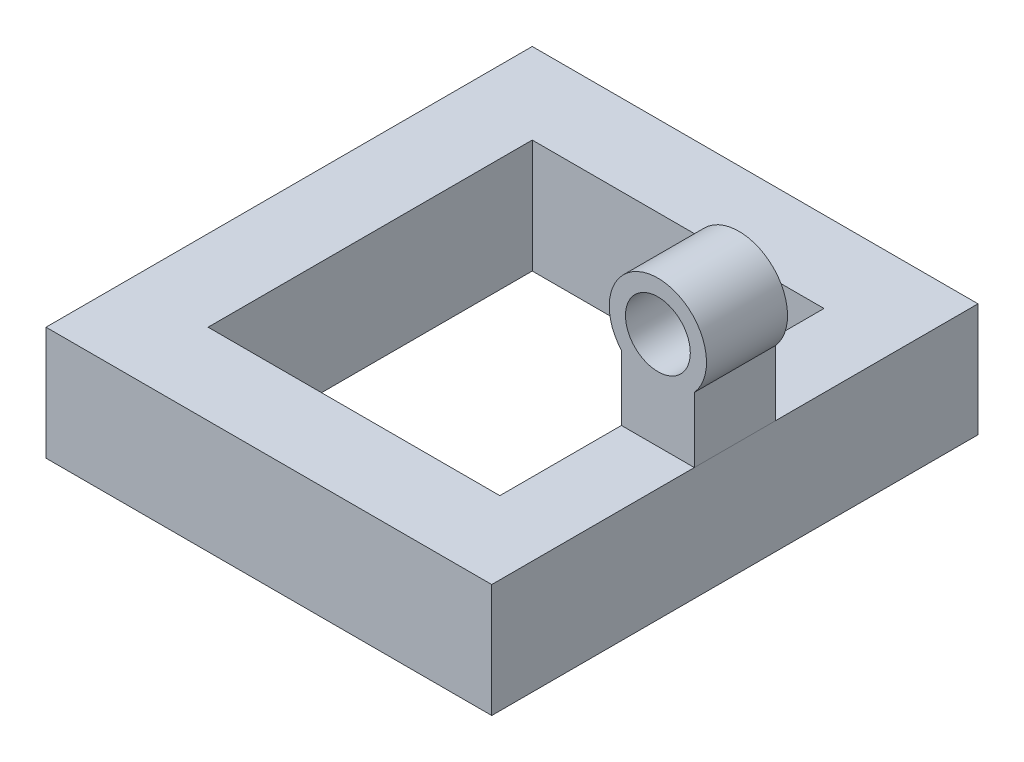
from build123d import *

# Parameters (mm, degrees)
SKETCH_1_W          = 55
SKETCH_1_H          = 60
EXTRUDE_1_DEPTH     = 14
SKETCH_5_W          = 36
SKETCH_5_H          = 40
CUT_EXTRUDE_1_DEPTH = 15
EXTRUDE_START       = -35
SKETCH_7_R          = 4
EXTRUDE_2_DEPTH     = 10


with BuildPart() as part:
    # 草图1 → 凸台-拉伸1 (new body)
    with BuildSketch(Plane(origin=(0, 0, 0), x_dir=(1, 0, 0), z_dir=(0, 1, 0))):
        with Locations((27.5, 30)):
            Rectangle(SKETCH_1_W, SKETCH_1_H)
    extrude(amount=EXTRUDE_1_DEPTH)

    # 草图5 → 切除-拉伸1 (cut)
    with BuildSketch(Plane(origin=(0, 0, 0), x_dir=(1, 0, 0), z_dir=(0, 1, 0))):
        with Locations((28, 30)):
            Rectangle(SKETCH_5_W, SKETCH_5_H)
    extrude(amount=CUT_EXTRUDE_1_DEPTH, mode=Mode.SUBTRACT)


with BuildPart() as body_2:
    # 草图7 → 凸台-拉伸2 (new body)
    with BuildSketch(Plane.XY.offset(EXTRUDE_START)):
        with BuildLine():
            Line((55, 14), (50.5, 14))
            Line((50.5, 14), (46, 14))
            Line((46, 14), (46, 22.031373033))
            ThreePointArc((46, 22.031373033), (50.5, 32), (55, 22.031373033))
            Line((55, 22.031373033), (55, 14))
        make_face()
        with Locations((50.5, 26)):
            Circle(SKETCH_7_R, mode=Mode.SUBTRACT)
    extrude(amount=EXTRUDE_2_DEPTH)


solid = Compound([part.part, body_2.part])
